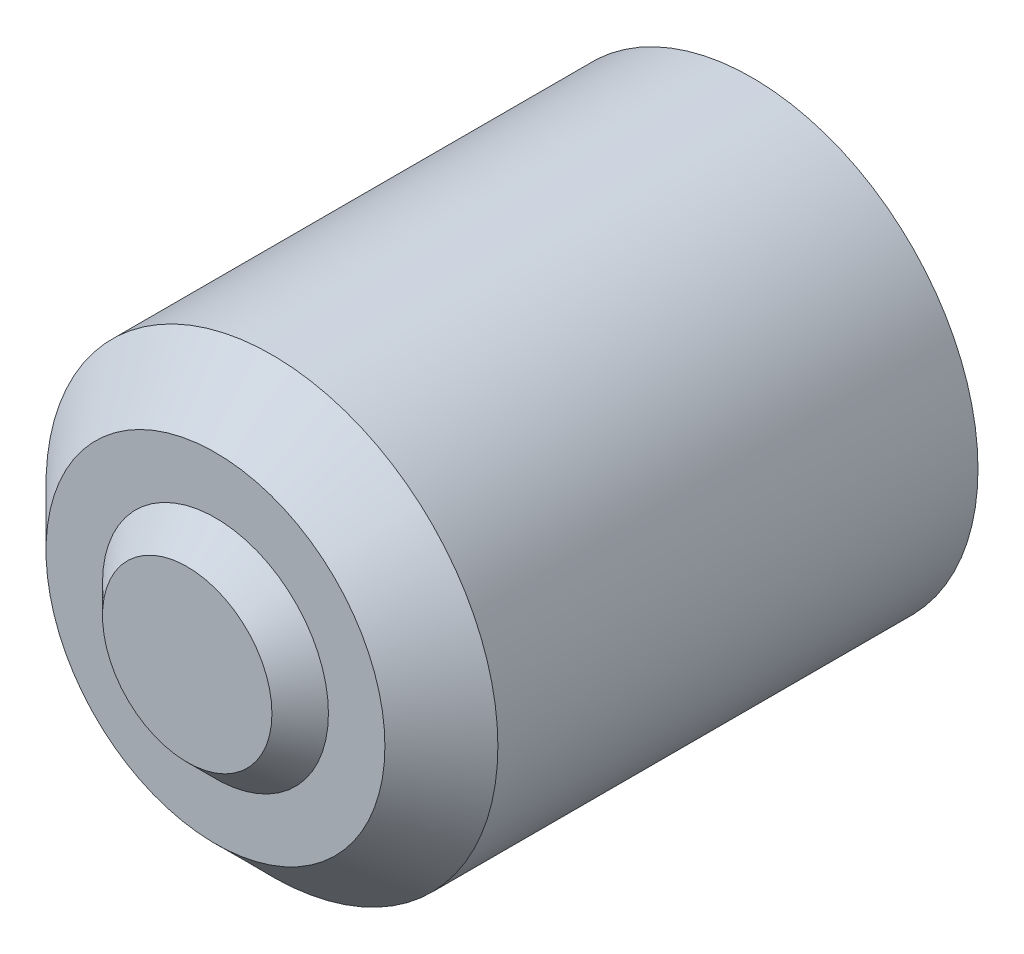
from build123d import *


with BuildPart() as part:
    # Sketch1 → Revolve1 (revolve)
    with BuildSketch(Plane(origin=(0, 0, 0), x_dir=(1, 0, 0), z_dir=(0, 1, 0))):
        Polygon((12, 30), (0, 30), (0, 0), (4.5, 0), (6, 1.5), (9, 1.5), (12, 4.5), align=None)
    revolve(axis=Axis((0, 0, -30), (0, 0, 1)))


solid = part.part
